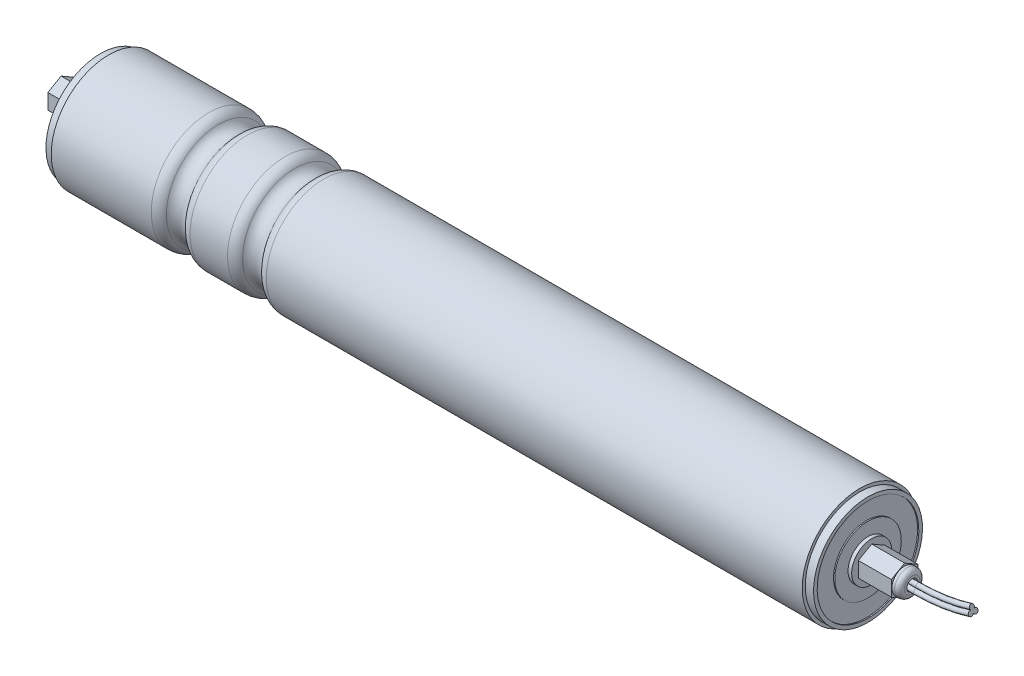
from build123d import *

# Parameters (mm, degrees)
BOSS_EXTRUDE1_DEPTH             = 14.986
BOSS_EXTRUDE2_DEPTH             = 17.018
SKETCH5_OUTSIDE_W               = 120.324
SKETCH5_OUTSIDE_H               = 120.324
SKETCH5_OUTSIDE_R               = 5.334
CUT_EXTRUDE1_DEPTH              = 3.175
FILLET1_R                       = 2.032
BOSS_EXTRUDE3_REACH             = 184.511
SKETCH6_R                       = 24.13
BOSS_EXTRUDE3_DIRECTION_2_REACH = 184.511
SKETCH8_R                       = 2.286
CUT_EXTRUDE2_DEPTH              = 5.08


with BuildPart() as part:
    # Sketch2 → Revolve1 (revolve)
    with BuildSketch(Plane.XY):
        Polygon((-162.607, 0), (-162.607, 8.382), (-161.083, 8.382), (-161.083, 13.97), (-160.575, 13.97), (-160.575, 21.336), (-161.083, 21.336), (-161.083, 22.86), (-157.607, 22.86), (-157.607, 0), align=None)
        Polygon((157.607, 0), (162.607, 0), (162.607, 8.382), (161.083, 8.382), (161.083, 13.97), (160.575, 13.97), (160.575, 21.336), (161.083, 21.336), (161.083, 22.86), (157.607, 22.86), align=None)
    revolve(axis=Axis((-162.607, 0, 0), (-1, 0, 0)))

    # Sketch3 → Boss-Extrude1 (add)
    with BuildSketch(Plane.ZY.offset(162.607)):
        Polygon((0, 6.415804866), (-5.55625, 3.207902433), (-5.55625, -3.207902433), (0, -6.415804866), (5.55625, -3.207902433), (5.55625, 3.207902433), align=None)
    extrude(amount=BOSS_EXTRUDE1_DEPTH)

    # Sketch4 → Boss-Extrude2 (add)
    with BuildSketch(Plane(origin=(162.607, 0, 0), x_dir=(0, 0, -1), z_dir=(1, 0, 0))):
        Polygon((5.55625, 3.207902433), (0, 6.415804866), (-5.55625, 3.207902433), (-5.55625, -3.207902433), (0, -6.415804866), (5.55625, -3.207902433), align=None)
    extrude(amount=BOSS_EXTRUDE2_DEPTH)

    # Sketch5 outside → Cut-Extrude1 (cut)
    with BuildSketch(Plane(origin=(179.625, 0, 0), x_dir=(0, 0, -1), z_dir=(1, 0, 0))):
        Rectangle(SKETCH5_OUTSIDE_W, SKETCH5_OUTSIDE_H)
        Circle(SKETCH5_OUTSIDE_R, mode=Mode.SUBTRACT)
    extrude(amount=-CUT_EXTRUDE1_DEPTH, mode=Mode.SUBTRACT)

    # Fillet1
    fillet1_edges = [part.edges().sort_by_distance(p)[0] for p in [
        (179.625, 0, 5.334),
    ]]
    fillet(fillet1_edges, radius=FILLET1_R)

    # Boss-Extrude3: up to this face of the body (flat: up to its plane)
    boss_extrude3_end = Plane(part.part.faces().sort_by_distance((-157.607, 0, 0))[0])
    # Sketch6 → Boss-Extrude3 (add, up to the picked face)
    with BuildSketch(Plane(origin=(0, 0, 0), x_dir=(0, 0, -1), z_dir=(1, 0, 0)), mode=Mode.PRIVATE) as boss_extrude3_sk1:
        with Locations(Location((0, 0, 0), (0, 0, 90))):
            Circle(SKETCH6_R)
    boss_extrude3_tool1 = split(extrude(boss_extrude3_sk1.sketch, amount=-BOSS_EXTRUDE3_REACH, mode=Mode.PRIVATE), bisect_by=boss_extrude3_end, keep=Keep.BOTH, mode=Mode.PRIVATE)
    add(boss_extrude3_tool1.solids().sort_by(Axis((0, 0, 0), (-1, 0, 0)))[0])

    # Boss-Extrude3 direction 2: up to this face of the body (flat: up to its plane)
    boss_extrude3_direction_2_end = Plane(part.part.faces().sort_by_distance((157.607, 0, 0))[0])
    # Sketch6 → Boss-Extrude3 direction 2 (add, up to the picked face)
    with BuildSketch(Plane(origin=(0, 0, 0), x_dir=(0, 0, -1), z_dir=(1, 0, 0)), mode=Mode.PRIVATE) as boss_extrude3_direction_2_sk1:
        with Locations(Location((0, 0, 0), (0, 0, 90))):
            Circle(SKETCH6_R)
    boss_extrude3_direction_2_tool1 = split(extrude(boss_extrude3_direction_2_sk1.sketch, amount=BOSS_EXTRUDE3_DIRECTION_2_REACH, mode=Mode.PRIVATE), bisect_by=boss_extrude3_direction_2_end, keep=Keep.BOTH, mode=Mode.PRIVATE)
    add(boss_extrude3_direction_2_tool1.solids().sort_by(Axis((0, 0, 0), (1, 0, 0)))[0])

    # Sketch7 → Cut-Revolve1 (revolve, cut)
    with BuildSketch(Plane.XY):
        with BuildLine():
            Line((-115.624933628, 24.13), (-99.353066372, 24.13))
            ThreePointArc((-99.353066372, 24.13), (-101.686205352, 23.519351244), (-103.421033186, 21.844))
            ThreePointArc((-103.421033186, 21.844), (-107.489, 19.558), (-111.556966814, 21.844))
            ThreePointArc((-111.556966814, 21.844), (-113.291794648, 23.519351244), (-115.624933628, 24.13))
        make_face()
        with BuildLine():
            Line((-67.349066372, 24.13), (-83.620933628, 24.13))
            ThreePointArc((-83.620933628, 24.13), (-81.287794648, 23.519351244), (-79.552966814, 21.844))
            ThreePointArc((-79.552966814, 21.844), (-75.485, 19.558), (-71.417033186, 21.844))
            ThreePointArc((-71.417033186, 21.844), (-69.682205352, 23.519351244), (-67.349066372, 24.13))
        make_face()
    revolve(axis=Axis((-165.1, 0, 0), (-1, 0, 0)), mode=Mode.SUBTRACT)

    # Sketch8 → Cut-Extrude2 (cut)
    with BuildSketch(Plane(origin=(179.625, 0, 0), x_dir=(0, 0, -1), z_dir=(1, 0, 0))):
        Circle(SKETCH8_R)
    extrude(amount=-CUT_EXTRUDE2_DEPTH, mode=Mode.SUBTRACT)

    # Sweep1: sweep along a path in Sketch10
    with BuildLine(Plane.XY) as sweep1_path:
        Line((174.545, 0), (182.165, 0))
        ThreePointArc((182.165, 0), (193.728936685, 0.882569293), (205.025, 3.509832852))
    # Sketch9 → Sweep1 (sweep)
    with BuildSketch(Plane(origin=(174.545, 0, 0), x_dir=(0, 0, -1), z_dir=(1, 0, 0))):
        with BuildLine():
            ThreePointArc((-0.693212205, 0.400226253), (-1.869748847, -1.0795), (0, -0.800452506))
            ThreePointArc((0, -0.800452506), (1.869748847, -1.0795), (0.693212205, 0.400226253))
            ThreePointArc((0.693212205, 0.400226253), (0, 2.159), (-0.693212205, 0.400226253))
        make_face()
    sweep(path=sweep1_path.line)


solid = part.part
